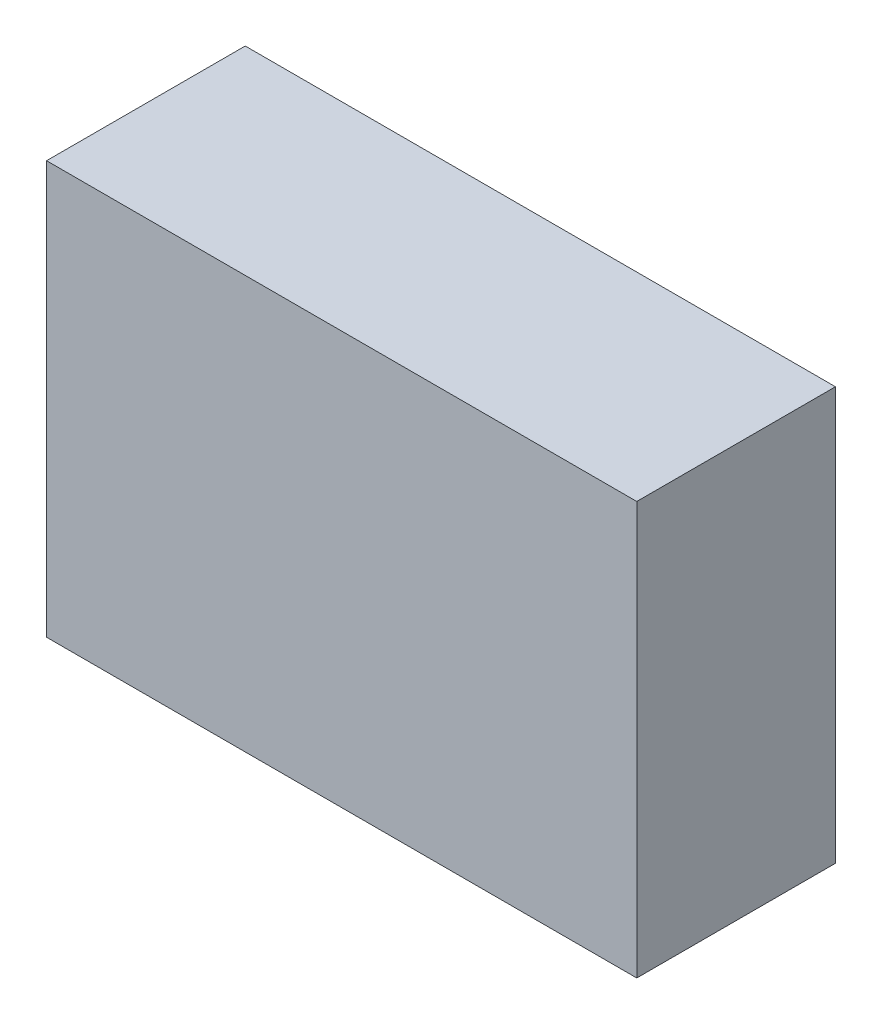
from build123d import *

# Parameters (mm, degrees)
SKETCH1_W           = 8.08
SKETCH1_H           = 5.65
BOSS_EXTRUDE1_DEPTH = 2.72
CUT_EXTRUDE1_DEPTH  = 4


with BuildPart() as part:
    # Sketch1 → Boss-Extrude1 (new body)
    with BuildSketch(Plane.XY):
        with Locations((4.04, 2.825)):
            Rectangle(SKETCH1_W, SKETCH1_H)
    extrude(amount=BOSS_EXTRUDE1_DEPTH)

    # Sketch2 → Cut-Extrude1 (cut)
    with BuildSketch(Plane.XZ):
        Polygon((0.54, 2.3), (7.54, 2.3), (6.425, 0.42), (1.655, 0.42), align=None)
    extrude(amount=-CUT_EXTRUDE1_DEPTH, mode=Mode.SUBTRACT)


solid = part.part
